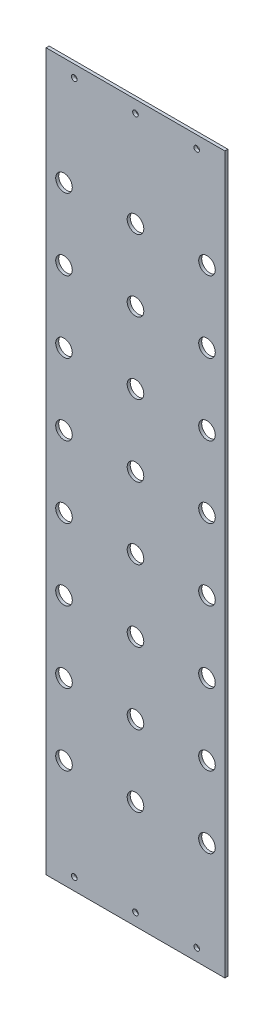
from build123d import *

# Parameters (mm, degrees)
SKETCH1_W        = 280.02
SKETCH1_H        = 1122
PLATE_DEPTH      = 4.76
HOLES_DEPTH      = 1157.424601087
HOLES_DEPTH_BACK = 1157.424601087
SKETCH2_R        = 4.37
SKETCH2_R_2      = 13


with BuildPart() as part:
    # Sketch1 → Plate (new body)
    with BuildSketch(Plane.XY):
        with Locations((140.01, 561)):
            Rectangle(SKETCH1_W, SKETCH1_H)
    extrude(amount=PLATE_DEPTH)

    # Sketch2 → Holes (cut, two sides: drawn at the far end of the back side and taken through both)
    with BuildSketch(Plane.XY.offset(-HOLES_DEPTH_BACK)):
        with Locations((44.06, 19.05)):
            Circle(SKETCH2_R)
        with Locations((44.06, 1102.95)):
            Circle(SKETCH2_R)
        with Locations((140.01, 19.05)):
            Circle(SKETCH2_R)
        with Locations((140.01, 1102.95)):
            Circle(SKETCH2_R)
        with Locations((235.96, 19.05)):
            Circle(SKETCH2_R)
        with Locations((235.96, 1102.95)):
            Circle(SKETCH2_R)
        with Locations((28.01, 169)):
            Circle(SKETCH2_R_2)
        with Locations((28.01, 281)):
            Circle(SKETCH2_R_2)
        with Locations((28.01, 393)):
            Circle(SKETCH2_R_2)
        with Locations((28.01, 505)):
            Circle(SKETCH2_R_2)
        with Locations((28.01, 617)):
            Circle(SKETCH2_R_2)
        with Locations((28.01, 729)):
            Circle(SKETCH2_R_2)
        with Locations((28.01, 841)):
            Circle(SKETCH2_R_2)
        with Locations((28.01, 953)):
            Circle(SKETCH2_R_2)
        with Locations((140.01, 169)):
            Circle(SKETCH2_R_2)
        with Locations((140.01, 281)):
            Circle(SKETCH2_R_2)
        with Locations((140.01, 393)):
            Circle(SKETCH2_R_2)
        with Locations((140.01, 505)):
            Circle(SKETCH2_R_2)
        with Locations((140.01, 617)):
            Circle(SKETCH2_R_2)
        with Locations((140.01, 729)):
            Circle(SKETCH2_R_2)
        with Locations((140.01, 841)):
            Circle(SKETCH2_R_2)
        with Locations((140.01, 953)):
            Circle(SKETCH2_R_2)
        with Locations((252.01, 169)):
            Circle(SKETCH2_R_2)
        with Locations((252.01, 281)):
            Circle(SKETCH2_R_2)
        with Locations((252.01, 393)):
            Circle(SKETCH2_R_2)
        with Locations((252.01, 505)):
            Circle(SKETCH2_R_2)
        with Locations((252.01, 617)):
            Circle(SKETCH2_R_2)
        with Locations((252.01, 729)):
            Circle(SKETCH2_R_2)
        with Locations((252.01, 841)):
            Circle(SKETCH2_R_2)
        with Locations((252.01, 953)):
            Circle(SKETCH2_R_2)
    extrude(amount=HOLES_DEPTH + HOLES_DEPTH_BACK, mode=Mode.SUBTRACT)


solid = part.part
